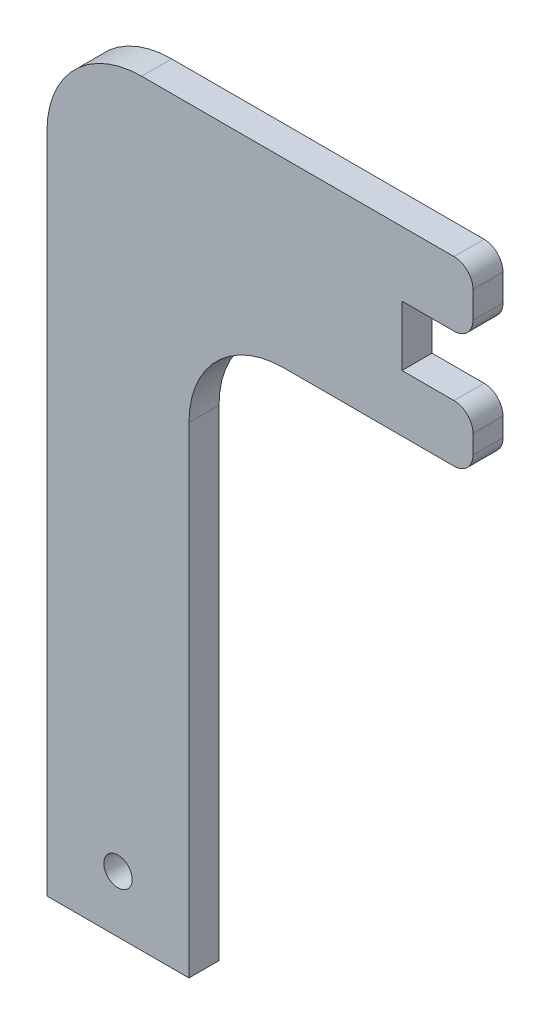
from build123d import *

# Parameters (mm, degrees)
SKETCH1_W           = 45
SKETCH1_H           = 80
BOSS_EXTRUDE1_DEPTH = 3.175
SKETCH2_W           = 15
SKETCH2_H           = 6.35
CUT_EXTRUDE1_DEPTH  = 92.842695001
SKETCH3_R           = 1.5
SKETCH3_W           = 30
SKETCH3_H           = 60.825
CUT_EXTRUDE2_DEPTH  = 92.842695001
FILLET1_R           = 10
FILLET2_R           = 2


with BuildPart() as part:
    # Sketch1 → Boss-Extrude1 (new body)
    with BuildSketch(Plane.XY):
        with Locations((-22.5, -40)):
            Rectangle(SKETCH1_W, SKETCH1_H)
    extrude(amount=BOSS_EXTRUDE1_DEPTH)

    # Sketch2 → Cut-Extrude1 (cut, through all)
    with BuildSketch(Plane.XY.offset(3.175)):
        with Locations((0, -10)):
            Rectangle(SKETCH2_W, SKETCH2_H)
    extrude(amount=-CUT_EXTRUDE1_DEPTH, mode=Mode.SUBTRACT)

    # Sketch3 → Cut-Extrude2 (cut, through all)
    with BuildSketch(Plane.XY.offset(3.175)):
        with Locations((-37.5, -74)):
            Circle(SKETCH3_R)
        with Locations((-15, -49.5875)):
            Rectangle(SKETCH3_W, SKETCH3_H)
    extrude(amount=-CUT_EXTRUDE2_DEPTH, mode=Mode.SUBTRACT)

    # Fillet1
    fillet1_edges = [part.edges().sort_by_distance(p)[0] for p in [
        (-30, -19.175, 1.5875),
        (-45, 0, 1.5875),
    ]]
    fillet(fillet1_edges, radius=FILLET1_R)

    # Fillet2
    fillet2_edges = [part.edges().sort_by_distance(p)[0] for p in [
        (0, -13.175, 1.5875),
        (0, -6.825, 1.5875),
        (0, -19.175, 1.5875),
        (0, 0, 1.5875),
    ]]
    fillet(fillet2_edges, radius=FILLET2_R)


solid = part.part
